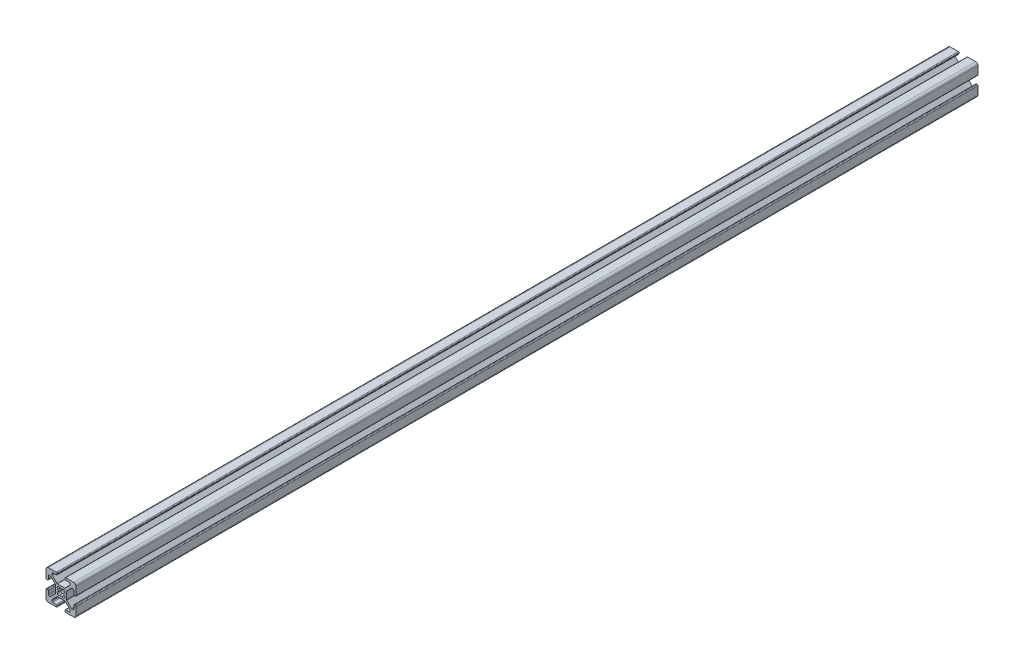
from build123d import *

# Parameters (mm, degrees)
EXTRUDE1_DEPTH = 600


with BuildPart() as part:
    # Sketch1 → Extrude1 (new body)
    with BuildSketch(Plane.XY):
        with BuildLine():
            Line((-5.032287798, -0.341059771), (-5.516287798, -0.341059771))
            ThreePointArc((-5.516287798, -0.341059771), (-5.875498042, -0.192270016), (-6.024287798, 0.166940229))
            Line((-6.024287798, 0.166940229), (-6.024287798, 2.515940229))
            ThreePointArc((-6.024287798, 2.515940229), (-6.173077553, 2.875150474), (-6.532287798, 3.023940229))
            Line((-6.532287798, 3.023940229), (-7.258207136, 3.023940229))
            ThreePointArc((-7.258207136, 3.023940229), (-7.45261032, 2.985271032), (-7.617417381, 2.875150474))
            Line((-7.617417381, 2.875150474), (-10.720498042, -0.227930187))
            ThreePointArc((-10.720498042, -0.227930187), (-10.8306186, -0.392737249), (-10.869287798, -0.587140432))
            Line((-10.869287798, -0.587140432), (-10.869287798, -5.354979109))
            ThreePointArc((-10.869287798, -5.354979109), (-10.8306186, -5.549382293), (-10.720498042, -5.714189354))
            Line((-10.720498042, -5.714189354), (-7.617417381, -8.817270016))
            ThreePointArc((-7.617417381, -8.817270016), (-7.45261032, -8.927390573), (-7.258207136, -8.966059771))
            Line((-7.258207136, -8.966059771), (-6.532287798, -8.966059771))
            ThreePointArc((-6.532287798, -8.966059771), (-6.173077553, -8.817270016), (-6.024287798, -8.458059771))
            Line((-6.024287798, -8.458059771), (-6.024287798, -6.109059771))
            ThreePointArc((-6.024287798, -6.109059771), (-5.875498042, -5.749849526), (-5.516287798, -5.601059771))
            Line((-5.516287798, -5.601059771), (-5.032287798, -5.601059771))
            ThreePointArc((-5.032287798, -5.601059771), (-4.673077553, -5.749849526), (-4.524287798, -6.109059771))
            Line((-4.524287798, -6.109059771), (-4.524287798, -11.471059771))
            ThreePointArc((-4.524287798, -11.471059771), (-4.963627626, -12.531719943), (-6.024287798, -12.971059771))
            Line((-6.024287798, -12.971059771), (-11.386287798, -12.971059771))
            ThreePointArc((-11.386287798, -12.971059771), (-11.745498042, -12.822270016), (-11.894287798, -12.463059771))
            Line((-11.894287798, -12.463059771), (-11.894287798, -11.979059771))
            ThreePointArc((-11.894287798, -11.979059771), (-11.745498042, -11.619849526), (-11.386287798, -11.471059771))
            Line((-11.386287798, -11.471059771), (-9.037287798, -11.471059771))
            ThreePointArc((-9.037287798, -11.471059771), (-8.678077553, -11.322270016), (-8.529287798, -10.963059771))
            Line((-8.529287798, -10.963059771), (-8.529287798, -10.237140432))
            ThreePointArc((-8.529287798, -10.237140432), (-8.567956995, -10.042737249), (-8.678077553, -9.877930187))
            Line((-8.678077553, -9.877930187), (-11.781158214, -6.774849526))
            ThreePointArc((-11.781158214, -6.774849526), (-11.945965275, -6.664728968), (-12.140368459, -6.626059771))
            Line((-12.140368459, -6.626059771), (-16.908207136, -6.626059771))
            ThreePointArc((-16.908207136, -6.626059771), (-17.10261032, -6.664728968), (-17.267417381, -6.774849526))
            Line((-17.267417381, -6.774849526), (-20.370498042, -9.877930187))
            ThreePointArc((-20.370498042, -9.877930187), (-20.4806186, -10.042737249), (-20.519287798, -10.237140432))
            Line((-20.519287798, -10.237140432), (-20.519287798, -10.963059771))
            ThreePointArc((-20.519287798, -10.963059771), (-20.370498042, -11.322270016), (-20.011287798, -11.471059771))
            Line((-20.011287798, -11.471059771), (-17.662287798, -11.471059771))
            ThreePointArc((-17.662287798, -11.471059771), (-17.303077553, -11.619849526), (-17.154287798, -11.979059771))
            Line((-17.154287798, -11.979059771), (-17.154287798, -12.463059771))
            ThreePointArc((-17.154287798, -12.463059771), (-17.303077553, -12.822270016), (-17.662287798, -12.971059771))
            Line((-17.662287798, -12.971059771), (-23.024287798, -12.971059771))
            ThreePointArc((-23.024287798, -12.971059771), (-24.084947969, -12.531719943), (-24.524287798, -11.471059771))
            Line((-24.524287798, -11.471059771), (-24.524287798, -6.109059771))
            ThreePointArc((-24.524287798, -6.109059771), (-24.375498042, -5.749849526), (-24.016287798, -5.601059771))
            Line((-24.016287798, -5.601059771), (-23.532287798, -5.601059771))
            ThreePointArc((-23.532287798, -5.601059771), (-23.173077553, -5.749849526), (-23.024287798, -6.109059771))
            Line((-23.024287798, -6.109059771), (-23.024287798, -8.458059771))
            ThreePointArc((-23.024287798, -8.458059771), (-22.875498042, -8.817270016), (-22.516287798, -8.966059771))
            Line((-22.516287798, -8.966059771), (-21.790368459, -8.966059771))
            ThreePointArc((-21.790368459, -8.966059771), (-21.595965275, -8.927390573), (-21.431158214, -8.817270016))
            Line((-21.431158214, -8.817270016), (-18.328077553, -5.714189354))
            ThreePointArc((-18.328077553, -5.714189354), (-18.217956995, -5.549382293), (-18.179287798, -5.354979109))
            Line((-18.179287798, -5.354979109), (-18.179287798, -0.587140432))
            ThreePointArc((-18.179287798, -0.587140432), (-18.217956995, -0.392737249), (-18.328077553, -0.227930187))
            Line((-18.328077553, -0.227930187), (-21.431158214, 2.875150474))
            ThreePointArc((-21.431158214, 2.875150474), (-21.595965275, 2.985271032), (-21.790368459, 3.023940229))
            Line((-21.790368459, 3.023940229), (-22.516287798, 3.023940229))
            ThreePointArc((-22.516287798, 3.023940229), (-22.875498042, 2.875150474), (-23.024287798, 2.515940229))
            Line((-23.024287798, 2.515940229), (-23.024287798, 0.166940229))
            ThreePointArc((-23.024287798, 0.166940229), (-23.173077553, -0.192270016), (-23.532287798, -0.341059771))
            Line((-23.532287798, -0.341059771), (-24.016287798, -0.341059771))
            ThreePointArc((-24.016287798, -0.341059771), (-24.375498042, -0.192270016), (-24.524287798, 0.166940229))
            Line((-24.524287798, 0.166940229), (-24.524287798, 5.528940229))
            ThreePointArc((-24.524287798, 5.528940229), (-24.084947969, 6.589600401), (-23.024287798, 7.028940229))
            Line((-23.024287798, 7.028940229), (-17.662287798, 7.028940229))
            ThreePointArc((-17.662287798, 7.028940229), (-17.303077553, 6.880150474), (-17.154287798, 6.520940229))
            Line((-17.154287798, 6.520940229), (-17.154287798, 6.036940229))
            ThreePointArc((-17.154287798, 6.036940229), (-17.303077553, 5.677729984), (-17.662287798, 5.528940229))
            Line((-17.662287798, 5.528940229), (-20.011287798, 5.528940229))
            ThreePointArc((-20.011287798, 5.528940229), (-20.370498042, 5.380150474), (-20.519287798, 5.020940229))
            Line((-20.519287798, 5.020940229), (-20.519287798, 4.295020891))
            ThreePointArc((-20.519287798, 4.295020891), (-20.4806186, 4.100617707), (-20.370498042, 3.935810646))
            Line((-20.370498042, 3.935810646), (-17.267417381, 0.832729984))
            ThreePointArc((-17.267417381, 0.832729984), (-17.10261032, 0.722609427), (-16.908207136, 0.683940229))
            Line((-16.908207136, 0.683940229), (-12.140368459, 0.683940229))
            ThreePointArc((-12.140368459, 0.683940229), (-11.945965275, 0.722609427), (-11.781158214, 0.832729984))
            Line((-11.781158214, 0.832729984), (-8.678077553, 3.935810646))
            ThreePointArc((-8.678077553, 3.935810646), (-8.567956995, 4.100617707), (-8.529287798, 4.295020891))
            Line((-8.529287798, 4.295020891), (-8.529287798, 5.020940229))
            ThreePointArc((-8.529287798, 5.020940229), (-8.678077553, 5.380150474), (-9.037287798, 5.528940229))
            Line((-9.037287798, 5.528940229), (-11.386287798, 5.528940229))
            ThreePointArc((-11.386287798, 5.528940229), (-11.745498042, 5.677729984), (-11.894287798, 6.036940229))
            Line((-11.894287798, 6.036940229), (-11.894287798, 6.520940229))
            ThreePointArc((-11.894287798, 6.520940229), (-11.745498042, 6.880150474), (-11.386287798, 7.028940229))
            Line((-11.386287798, 7.028940229), (-6.024287798, 7.028940229))
            ThreePointArc((-6.024287798, 7.028940229), (-4.963627626, 6.589600401), (-4.524287798, 5.528940229))
            Line((-4.524287798, 5.528940229), (-4.524287798, 0.166940229))
            ThreePointArc((-4.524287798, 0.166940229), (-4.673077553, -0.192270016), (-5.032287798, -0.341059771))
        make_face()
        with BuildLine():
            Line((-12.399386954, -5.275565737), (-12.219781831, -5.095960615))
            ThreePointArc((-12.219781831, -5.095960615), (-12.018349781, -4.327527582), (-12.589154291, -3.775036489))
            ThreePointArc((-12.589154291, -3.775036489), (-12.428787798, -2.971059771), (-12.589154291, -2.167083053))
            ThreePointArc((-12.589154291, -2.167083053), (-12.018349781, -1.61459196), (-12.219781831, -0.846158927))
            Line((-12.219781831, -0.846158927), (-12.399386954, -0.666553805))
            ThreePointArc((-12.399386954, -0.666553805), (-13.167819987, -0.465121754), (-13.72031108, -1.035926265))
            ThreePointArc((-13.72031108, -1.035926265), (-14.524287798, -0.875559771), (-15.328264516, -1.035926265))
            ThreePointArc((-15.328264516, -1.035926265), (-15.880755608, -0.465121754), (-16.649188641, -0.666553805))
            Line((-16.649188641, -0.666553805), (-16.828793764, -0.846158927))
            ThreePointArc((-16.828793764, -0.846158927), (-17.030225814, -1.61459196), (-16.459421304, -2.167083053))
            ThreePointArc((-16.459421304, -2.167083053), (-16.619787798, -2.971059771), (-16.459421304, -3.775036489))
            ThreePointArc((-16.459421304, -3.775036489), (-17.030225814, -4.327527582), (-16.828793764, -5.095960615))
            Line((-16.828793764, -5.095960615), (-16.649188641, -5.275565737))
            ThreePointArc((-16.649188641, -5.275565737), (-15.880755608, -5.476997788), (-15.328264516, -4.906193277))
            ThreePointArc((-15.328264516, -4.906193277), (-14.524287798, -5.066559771), (-13.72031108, -4.906193277))
            ThreePointArc((-13.72031108, -4.906193277), (-13.167819987, -5.476997788), (-12.399386954, -5.275565737))
        make_face(mode=Mode.SUBTRACT)
    extrude(amount=EXTRUDE1_DEPTH)


solid = part.part
